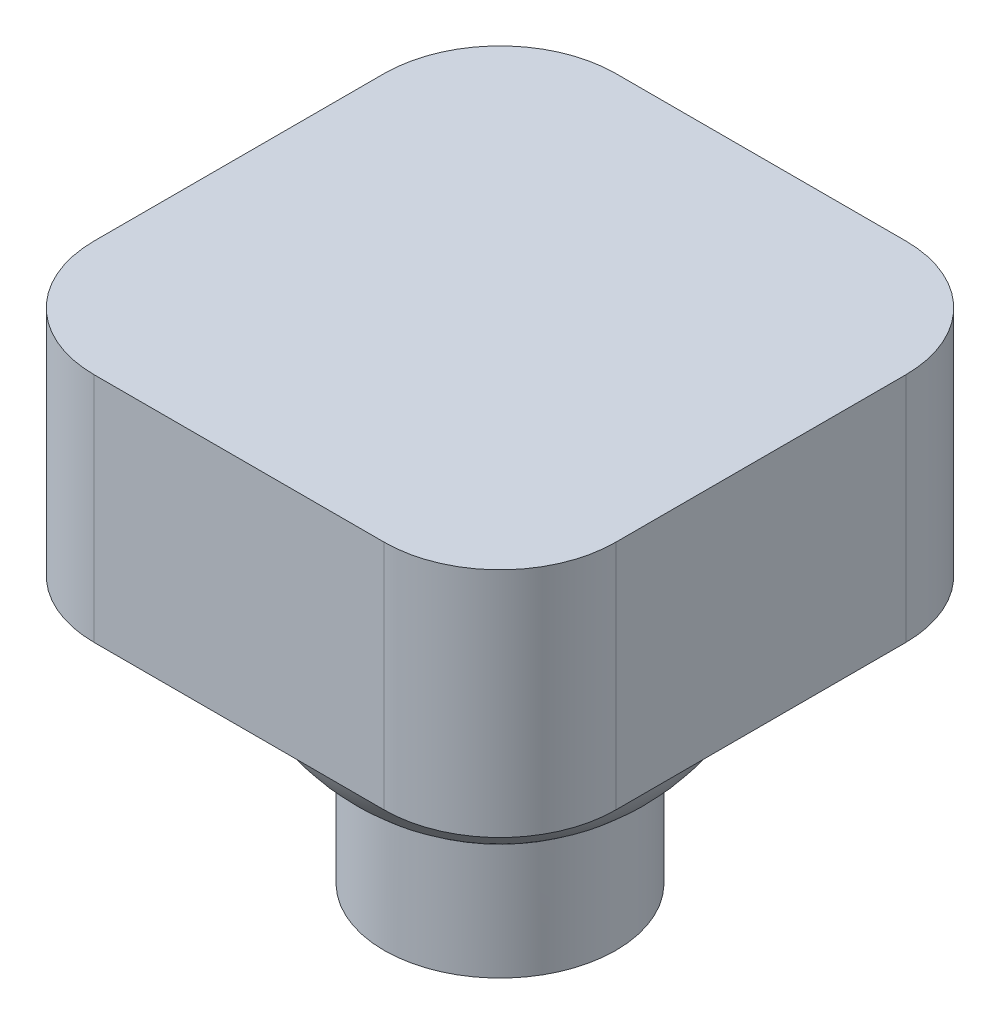
from build123d import *

# Parameters (mm, degrees)
SKETCH1_R           = 25.4
BOSS_EXTRUDE1_DEPTH = 25.4
SKETCH3_W           = 114.3
SKETCH3_H           = 114.3
BOSS_EXTRUDE2_DEPTH = 50.8
FILLET1_R           = 25.4


with BuildPart() as part:
    # Sketch1 → Boss-Extrude1 (new body)
    with BuildSketch(Plane(origin=(0, 0, 0), x_dir=(1, 0, 0), z_dir=(0, 1, 0))):
        with Locations(Location((0, 0, 0), (0, 0, 270))):
            Circle(SKETCH1_R)
    extrude(amount=BOSS_EXTRUDE1_DEPTH)

    # Sketch2 one side → Revolve1 (revolve)
    with BuildSketch(Plane.XY):
        with BuildLine():
            Line((25.4, 25.4), (0, 25.4))
            Line((0, 25.4), (0, 17.427972806))
            ThreePointArc((0, 17.427972806), (13.310834098, 19.467783044), (25.4, 25.4))
        make_face()
        with BuildLine():
            ThreePointArc((44.45, 61.877972806), (31.430896424, 93.308869229), (0, 106.327972806))
            Line((0, 106.327972806), (0, 25.4))
            Line((0, 25.4), (25.4, 25.4))
            ThreePointArc((25.4, 25.4), (39.400713826, 41.301621088), (44.45, 61.877972806))
        make_face()
    revolve(axis=Axis((0, 145.460296173, 0), (0, -1, 0)))

    # Sketch3 → Boss-Extrude2 (add)
    with BuildSketch(Plane(origin=(0, 58.42, 0), x_dir=(1, 0, 0), z_dir=(0, 1, 0))):
        Rectangle(SKETCH3_W, SKETCH3_H)
    extrude(amount=BOSS_EXTRUDE2_DEPTH)

    # Fillet1
    fillet1_edges = [part.edges().sort_by_distance(p)[0] for p in [
        (-57.15, 83.82, 57.15),
        (57.15, 83.82, 57.15),
        (57.15, 83.82, -57.15),
        (-57.15, 83.82, -57.15),
    ]]
    fillet(fillet1_edges, radius=FILLET1_R)


solid = part.part
